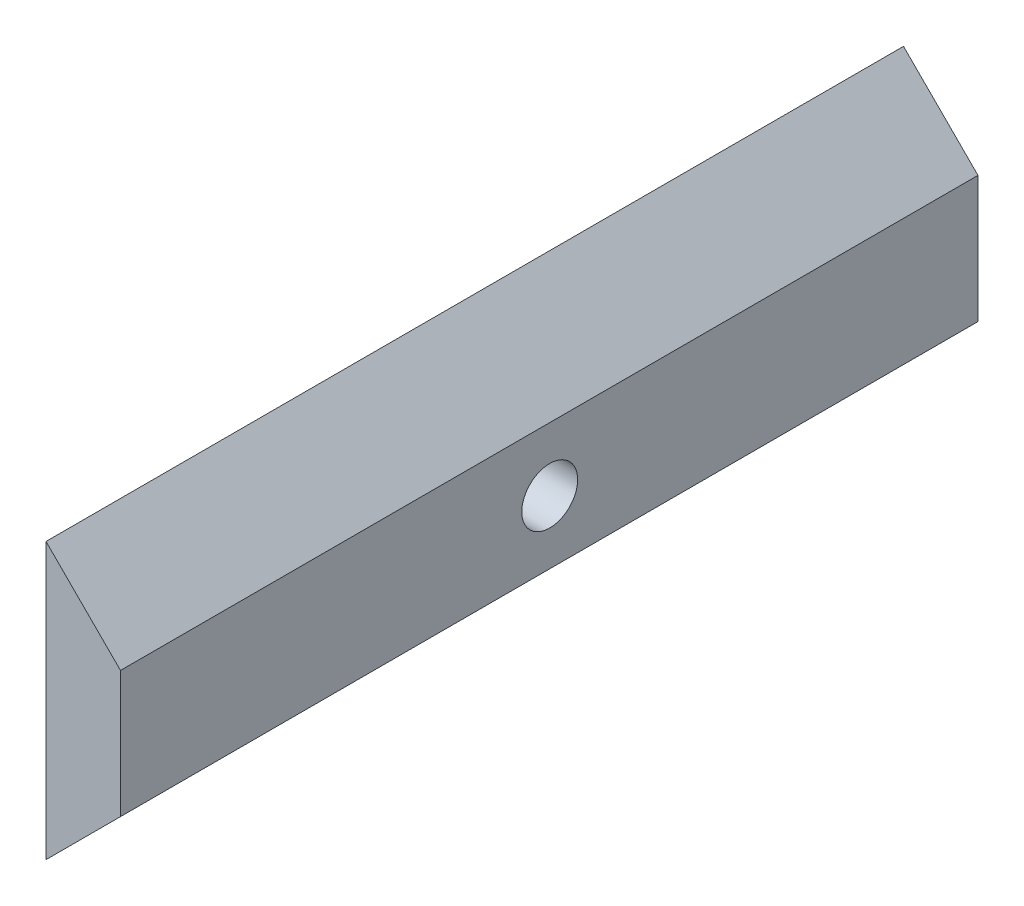
from build123d import *

# Parameters (mm, degrees)
BOSS_EXTRUDE1_DEPTH  = 23.025
F_1_5MM_DOWEL_HOLE_D = 1.5


with BuildPart() as part:
    # Sketch1 → Boss-Extrude1 (new body)
    with BuildSketch(Plane.XY):
        Polygon((10.746560597, -0.102705017), (12.746560597, 1.897294983), (12.746560597, 5.297294983), (10.746560597, 7.297294983), align=None)
    extrude(amount=BOSS_EXTRUDE1_DEPTH)

    # Ø1.5mm Dowel Hole (through all)
    with Locations(Plane(origin=(14.246560597, -88.102705017, 36.5), x_dir=(0, 0, -1), z_dir=(1, 0, 0))):
        with Locations((0, 91.7), (-25, 91.7), (25, 91.7)):
            Hole(F_1_5MM_DOWEL_HOLE_D / 2)


solid = part.part
